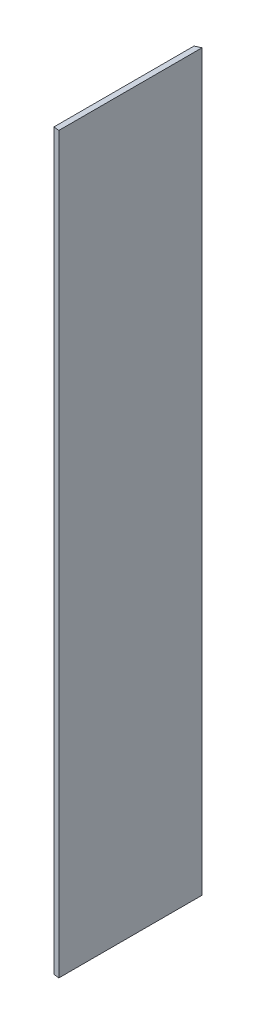
from build123d import *

# Parameters (mm, degrees)
EXTRUDE_1_DEPTH = 533.213673317


with BuildPart() as part:
    # Эскиз1 → Вытянуть1 (new body)
    with BuildSketch(Plane(origin=(0, 0, 0), x_dir=(1, 0, 0), z_dir=(0, 1, 0))):
        Polygon((1.026379046, -5.553244715), (1.026379046, -107.324896908), (5.026379046, -107.838799799), (5.026379046, -3.763508183), align=None)
    extrude(amount=EXTRUDE_1_DEPTH)


solid = part.part
